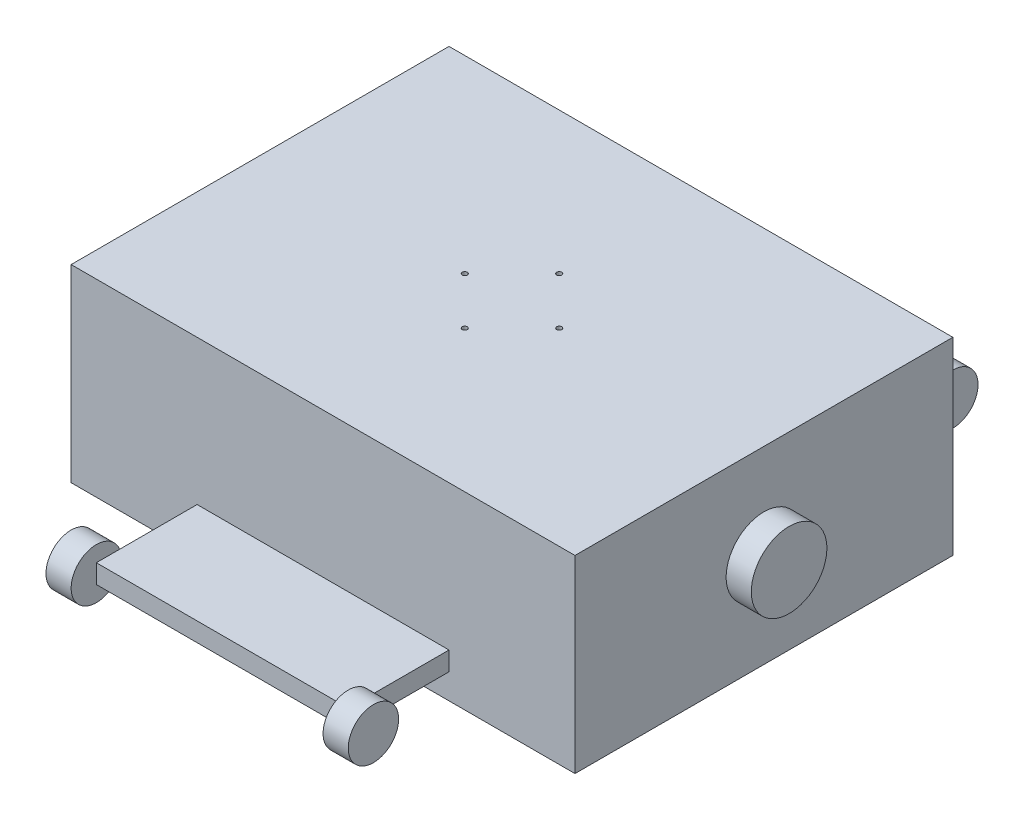
from build123d import *

# Parameters (mm, degrees)
SKETCH_1_W               = 400
SKETCH_1_H               = 150
EXTRUDE_1_DEPTH          = 300
SKETCH_2_R               = 30
EXTRUDE_2_DEPTH          = 20
SKETCH_8_W               = 200
SKETCH_8_H               = 15
EXTRUDE_6_DEPTH          = 80
SKETCH_9_R               = 20
EXTRUDE_7_DEPTH          = 20
MIRROR_4_COPY_1_SKETCH_R = 20
MIRROR_4_COPY_1_DEPTH    = 20
SKETCH_10_R              = 2
CUT_EXTRUDE_1_DEPTH      = 10
EXTRUDE_START            = 20
SKETCH_6_R               = 30
EXTRUDE_8_DEPTH          = 20


with BuildPart() as part:
    # 草图1 → 凸台-拉伸1 (new body)
    with BuildSketch(Plane.XY):
        Rectangle(SKETCH_1_W, SKETCH_1_H)
    extrude(amount=-EXTRUDE_1_DEPTH)

    # 草图2 → 凸台-拉伸2 (add)
    with BuildSketch(Plane(origin=(200, 0, 0), x_dir=(0, 0, -1), z_dir=(1, 0, 0))):
        with Locations(Location((150, 0, 0), (0, 0, 90))):
            Circle(SKETCH_2_R)
    extrude(amount=EXTRUDE_2_DEPTH)

    # 草图8 → 凸台-拉伸6 (add)
    with BuildSketch(Plane.XY):
        with Locations((0, -47.5)):
            Rectangle(SKETCH_8_W, SKETCH_8_H)
    extrude_6 = extrude(amount=EXTRUDE_6_DEPTH)

    # 镜向2: 凸台-拉伸6 across plane
    add(extrude_6.mirror(Plane.XY.offset(-150)))

    # 草图9 → 凸台-拉伸7 (add)
    with BuildSketch(Plane(origin=(100, 0, 0), x_dir=(0, 0, -1), z_dir=(1, 0, 0))):
        with Locations(Location((-80, -47.5, 0), (0, 0, 337.975687163))):
            Circle(SKETCH_9_R)
    extrude_7 = extrude(amount=EXTRUDE_7_DEPTH)

    # 镜向3: 凸台-拉伸7 across plane
    add(extrude_7.mirror(Plane.XY.offset(-150)))

    # 镜向4: 凸台-拉伸7 across plane
    add(extrude_7.mirror(Plane(origin=(0, 0, 0), x_dir=(0, 0, 1), z_dir=(1, 0, 0))))

    # 镜向4 copy 1 sketch → 镜向4 copy 1 (add)
    with BuildSketch(Plane(origin=(-100, 0, -300), x_dir=(0, 0, 1), z_dir=(-1, 0, 0))):
        with Locations(Location((-80, -47.5, 0), (0, 0, 337.975687163))):
            Circle(MIRROR_4_COPY_1_SKETCH_R)
    extrude(amount=MIRROR_4_COPY_1_DEPTH)

    # 草图10 → 切除-拉伸1 (cut)
    with BuildSketch(Plane(origin=(0, 75, 0), x_dir=(1, 0, 0), z_dir=(0, 1, 0))):
        with Locations(Location((0, 187.5, 0), (0, 0, 270))):
            Circle(SKETCH_10_R)
        with Locations(Location((37.5, 150, 0), (0, 0, 270))):
            Circle(SKETCH_10_R)
        with Locations(Location((0, 112.5, 0), (0, 0, 270))):
            Circle(SKETCH_10_R)
        with Locations(Location((-37.5, 150, 0), (0, 0, 270))):
            Circle(SKETCH_10_R)
    extrude(amount=-CUT_EXTRUDE_1_DEPTH, mode=Mode.SUBTRACT)

    # 草图6 → 凸台-拉伸8 (add)
    with BuildSketch(Plane.ZY.offset(200).offset(EXTRUDE_START)):
        with Locations(Location((-150, 0, 0), (0, 0, 90))):
            Circle(SKETCH_6_R)
    extrude(amount=-EXTRUDE_8_DEPTH)


solid = part.part
